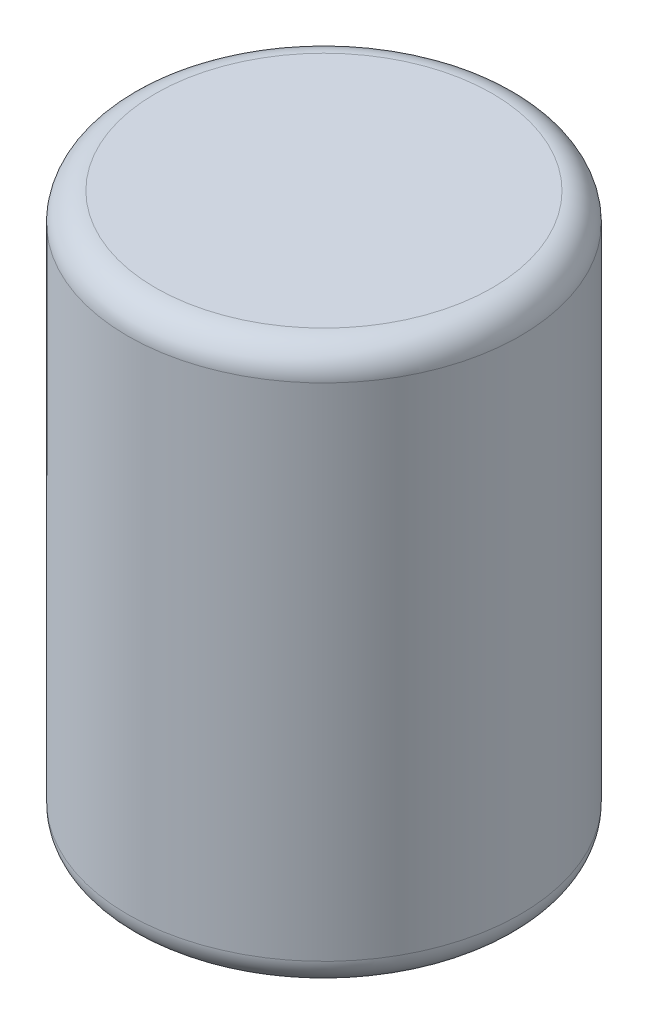
from build123d import *

# Parameters (mm, degrees)
SKETCH1_R           = 14.1
BOSS_EXTRUDE1_DEPTH = 40
FILLET1_R           = 2


with BuildPart() as part:
    # Sketch1 → Boss-Extrude1 (new body)
    with BuildSketch(Plane(origin=(0, 0, 0), x_dir=(1, 0, 0), z_dir=(0, 1, 0))):
        with Locations(Location((0, 0, 0), (0, 0, 270))):
            Circle(SKETCH1_R)
    extrude(amount=BOSS_EXTRUDE1_DEPTH)

    # Fillet1
    fillet1_edges = [part.edges().sort_by_distance(p)[0] for p in [
        (0, 0, -14.1),
        (0, 40, -14.1),
    ]]
    fillet(fillet1_edges, radius=FILLET1_R)


solid = part.part
